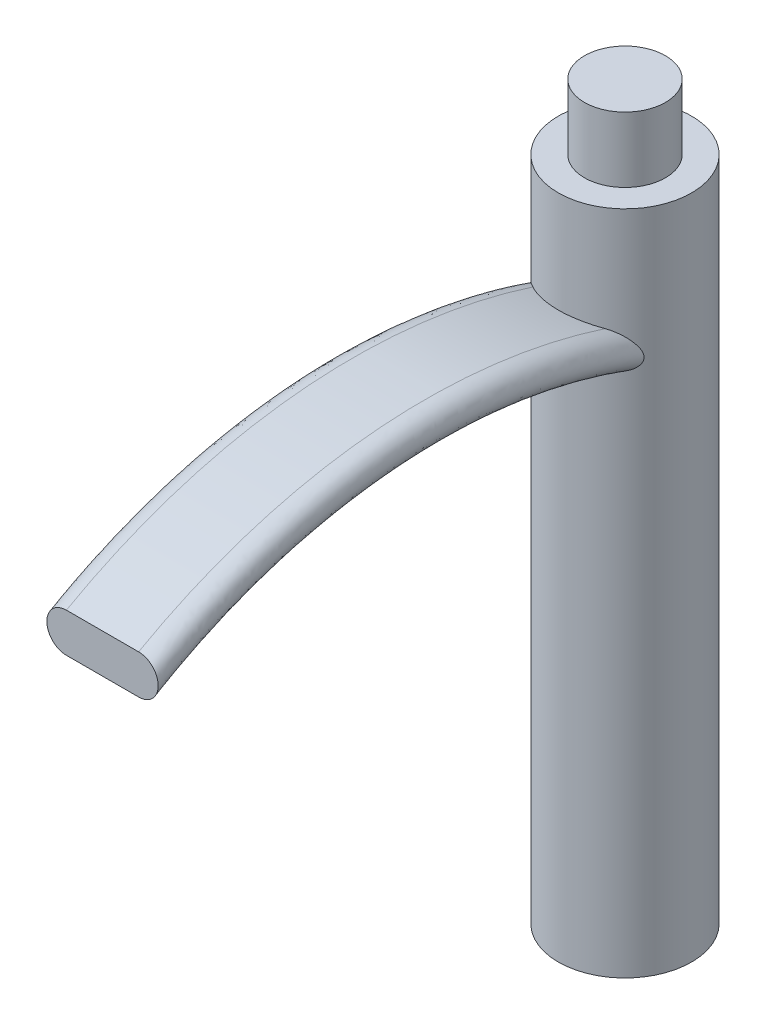
from build123d import *

# Parameters (mm, degrees)
SKETCH1_R           = 25.5
BOSS_EXTRUDE1_DEPTH = 255
SKETCH5_R           = 15.5
BOSS_EXTRUDE2_DEPTH = 25


with BuildPart() as part:
    # Sketch1 → Boss-Extrude1 (new body)
    with BuildSketch(Plane(origin=(0, 0, 0), x_dir=(1, 0, 0), z_dir=(0, 1, 0))):
        with Locations(Location((0, 0, 0), (0, 0, 270))):
            Circle(SKETCH1_R)
    extrude(amount=BOSS_EXTRUDE1_DEPTH)

    # Sweep1: sweep along a path in Sketch4
    with BuildLine(Plane(origin=(0, 0, 0), x_dir=(0, 0, -1), z_dir=(1, 0, 0))) as sweep1_path:
        ThreePointArc((-200, 189.54), (-101.226787493, 219.07574986), (0, 199.54))
    # Sketch3 → Sweep1 (sweep)
    with BuildSketch(Plane.XY.offset(200)):
        with BuildLine():
            Line((-13.819688726, 197.030082188), (13.819688726, 197.030082188))
            ThreePointArc((13.819688726, 197.030082188), (21.309770914, 189.54), (13.819688726, 182.049917812))
            Line((13.819688726, 182.049917812), (-13.819688726, 182.049917812))
            ThreePointArc((-13.819688726, 182.049917812), (-21.309770914, 189.54), (-13.819688726, 197.030082188))
        make_face()
    sweep(path=sweep1_path.line)

    # Sketch5 → Boss-Extrude2 (add)
    with BuildSketch(Plane(origin=(0, 255, 0), x_dir=(1, 0, 0), z_dir=(0, 1, 0))):
        with Locations(Location((0, 0, 0), (0, 0, 270))):
            Circle(SKETCH5_R)
    extrude(amount=BOSS_EXTRUDE2_DEPTH)


solid = part.part
